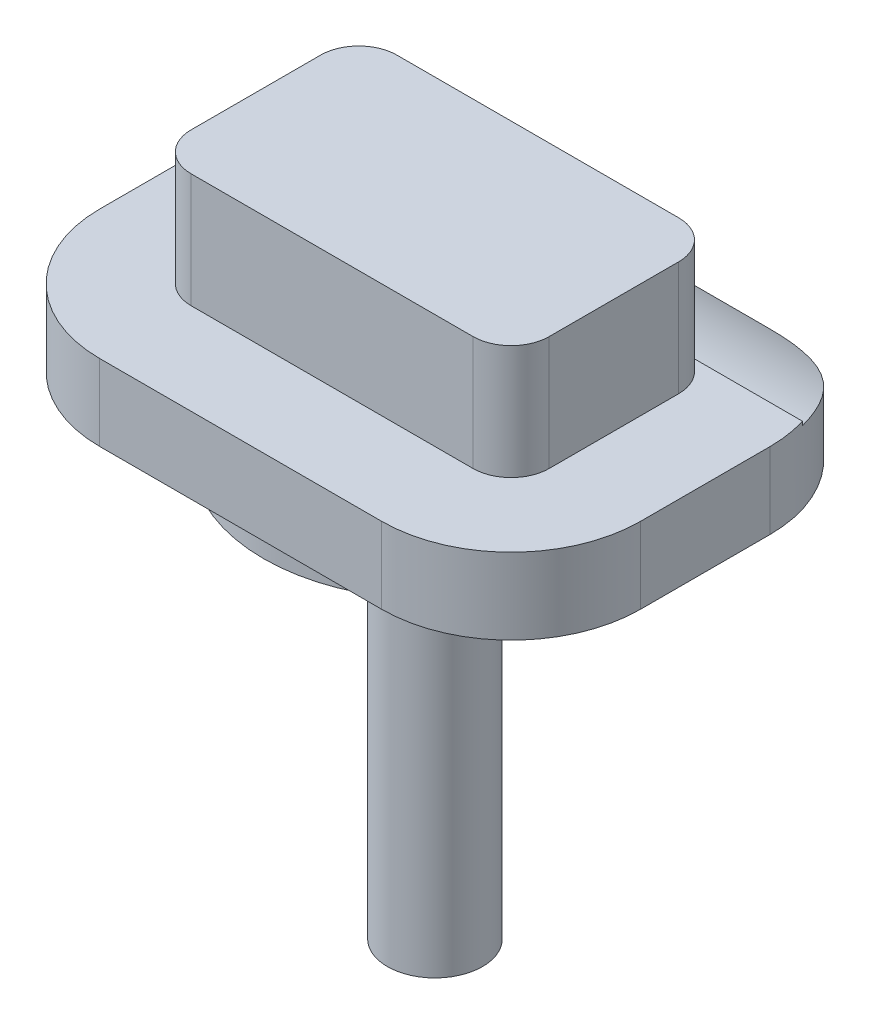
from build123d import *

# Parameters (mm, degrees)
BOSS_EXTRUDE1_DEPTH = 3
BOSS_EXTRUDE2_DEPTH = 2
CUT_EXTRUDE1_DEPTH  = 17.476650145
SKETCH6_R           = 3.5
SKETCH6_R_2         = 2.65
CUT_EXTRUDE3_DEPTH  = 1
BOSS_EXTRUDE4_START = 1
SKETCH7_R           = 2.65
BOSS_EXTRUDE4_DEPTH = 1
BOSS_EXTRUDE5_START = 1
SKETCH8_R           = 4.5
SKETCH8_R_2         = 3.5
BOSS_EXTRUDE5_DEPTH = 1
SKETCH9_R           = 1.25
BOSS_EXTRUDE6_DEPTH = 10.9
CHAMFER2_SIZE       = 1


with BuildPart() as part:
    # Sketch1 → Boss-Extrude1 (new body)
    with BuildSketch(Plane(origin=(0, 0, 0), x_dir=(1, 0, 0), z_dir=(0, 1, 0))):
        with BuildLine():
            Line((1, 0), (8.4, 0))
            ThreePointArc((8.4, 0), (9.107106781, 0.292893219), (9.4, 1))
            Line((9.4, 1), (9.4, 4.4))
            ThreePointArc((9.4, 4.4), (9.107106781, 5.107106781), (8.4, 5.4))
            Line((8.4, 5.4), (1, 5.4))
            ThreePointArc((1, 5.4), (0.292893219, 5.107106781), (0, 4.4))
            Line((0, 4.4), (0, 1))
            ThreePointArc((0, 1), (0.292893219, 0.292893219), (1, 0))
        make_face()
    extrude(amount=BOSS_EXTRUDE1_DEPTH)

    # Sketch2 → Boss-Extrude2 (add)
    with BuildSketch(Plane.XZ):
        with BuildLine():
            Line((1, -7.8), (8.4, -7.8))
            ThreePointArc((8.4, -7.8), (10.804163056, -6.804163056), (11.8, -4.4))
            Line((11.8, -4.4), (11.8, -1))
            ThreePointArc((11.8, -1), (10.804163056, 1.404163056), (8.4, 2.4))
            Line((8.4, 2.4), (1, 2.4))
            ThreePointArc((1, 2.4), (-1.404163056, 1.404163056), (-2.4, -1))
            Line((-2.4, -1), (-2.4, -4.4))
            ThreePointArc((-2.4, -4.4), (-1.404163056, -6.804163056), (1, -7.8))
        make_face()
    extrude(amount=BOSS_EXTRUDE2_DEPTH)

    # Sketch3 → Cut-Extrude1 (cut, through all)
    with BuildSketch(Plane.ZY.offset(2.4)):
        with BuildLine():
            Line((-5.4, -0.1), (-5.4, 0.4))
            Line((-5.4, 0.4), (-7.8, 0.4))
            Line((-7.8, 0.4), (-7.8, -0.73))
            ThreePointArc((-7.8, -0.73), (-6.63183862, -0.29371002), (-5.4, -0.1))
        make_face()
    extrude(amount=-CUT_EXTRUDE1_DEPTH, mode=Mode.SUBTRACT)

    # Sketch6 → Cut-Extrude3 (cut)
    with BuildSketch(Plane.XZ.offset(2)):
        with Locations(Location((4.7, -2.7, 0), (0, 0, 270))):
            Circle(SKETCH6_R)
        with Locations(Location((4.7, -2.7, 0), (0, 0, 270))):
            Circle(SKETCH6_R_2, mode=Mode.SUBTRACT)
    extrude(amount=-CUT_EXTRUDE3_DEPTH, mode=Mode.SUBTRACT)

    # Sketch7 → Boss-Extrude4 (add)
    with BuildSketch(Plane.XZ.offset(2).offset(BOSS_EXTRUDE4_START)):
        with Locations(Location((4.7, -2.7, 0), (0, 0, 270))):
            Circle(SKETCH7_R)
    extrude(amount=-BOSS_EXTRUDE4_DEPTH)

    # Sketch8 → Boss-Extrude5 (add)
    with BuildSketch(Plane.XZ.offset(2).offset(BOSS_EXTRUDE5_START)):
        with Locations(Location((4.7, -2.7, 0), (0, 0, 270))):
            Circle(SKETCH8_R)
        with Locations(Location((4.7, -2.7, 0), (0, 0, 270))):
            Circle(SKETCH8_R_2, mode=Mode.SUBTRACT)
    extrude(amount=-BOSS_EXTRUDE5_DEPTH)

    # Sketch9 → Boss-Extrude6 (add)
    with BuildSketch(Plane.XZ.offset(3)):
        with Locations(Location((4.7, -2.7, 0), (0, 0, 270))):
            Circle(SKETCH9_R)
    extrude(amount=BOSS_EXTRUDE6_DEPTH)

    # Chamfer2
    chamfer2_edges = [part.edges().sort_by_distance(p)[0] for p in [
        (4.7, -3, -1.45),
    ]]
    chamfer(chamfer2_edges, length=CHAMFER2_SIZE)


solid = part.part
